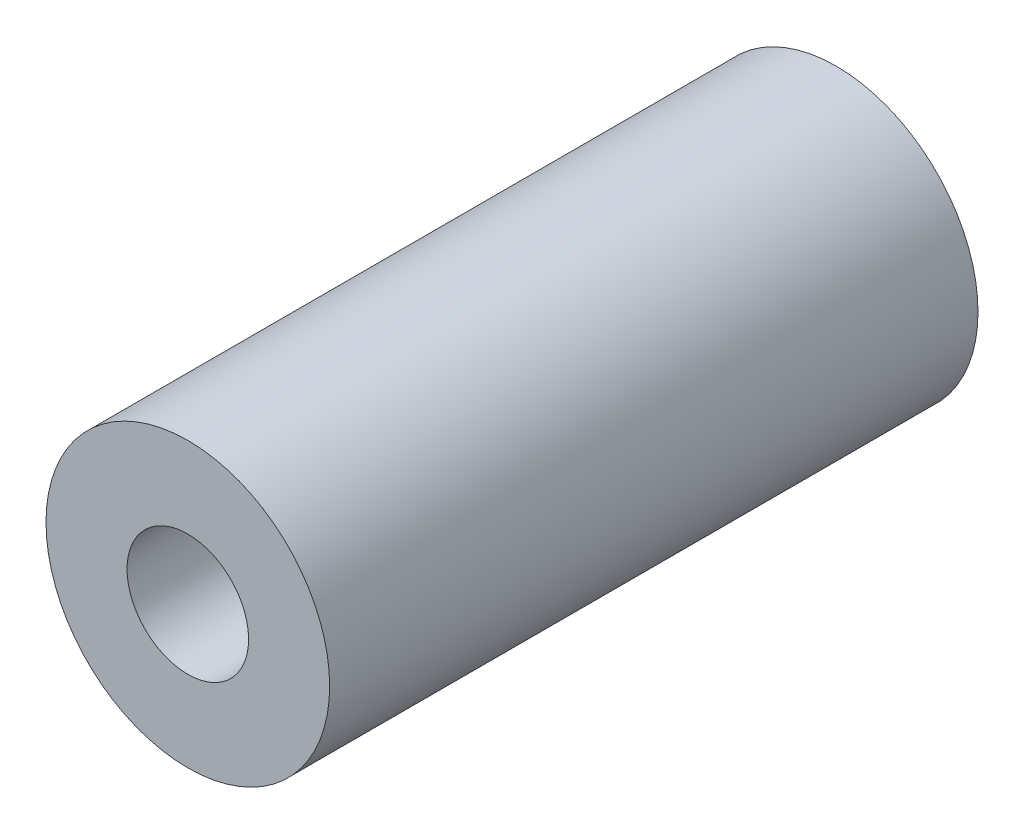
from build123d import *

# Parameters (mm, degrees)
SKETCH_1_R      = 3.5
SKETCH_1_R_2    = 1.5
EXTRUDE_1_DEPTH = 16


with BuildPart() as part:
    # 草图1 → 拉伸1 (new body)
    with BuildSketch(Plane.XY):
        Circle(SKETCH_1_R)
        Circle(SKETCH_1_R_2, mode=Mode.SUBTRACT)
    extrude(amount=EXTRUDE_1_DEPTH)


solid = part.part
